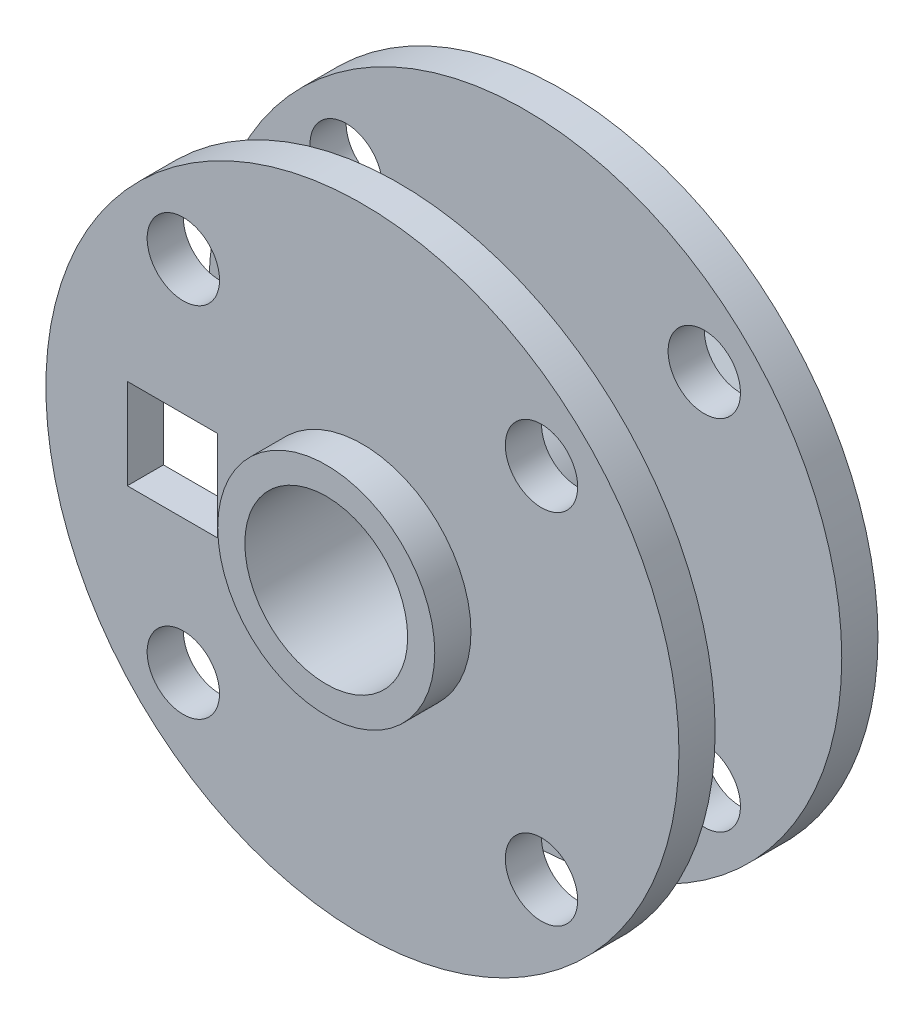
from build123d import *

# Parameters (mm, degrees)
SKETCH_1_R          = 17.5
EXTRUDE_1_DEPTH     = 2
SKETCH_2_R          = 7
EXTRUDE_2_DEPTH     = 7
SKETCH_3_R          = 17.5
EXTRUDE_3_DEPTH     = 2
SKETCH_4_W          = 5
SKETCH_4_H          = 5
CUT_EXTRUDE_1_DEPTH = 18
SKETCH_5_R          = 4.5
CUT_EXTRUDE_2_DEPTH = 18
SKETCH_6_R          = 6
SKETCH_6_R_2        = 4.5
EXTRUDE_4_DEPTH     = 2
SKETCH_7_R          = 2
CUT_EXTRUDE_3_DEPTH = 20
EXTRUDE_START       = 2
SKETCH_8_R          = 6
SKETCH_8_R_2        = 4.5
EXTRUDE_5_DEPTH     = 2
EXTRUDE_START_2     = 3
SKETCH_10_R         = 4.5
EXTRUDE_6_DEPTH     = 3


with BuildPart() as part:
    # 草图1 → 凸台-拉伸1 (new body)
    with BuildSketch(Plane.XY):
        Circle(SKETCH_1_R)
    extrude(amount=EXTRUDE_1_DEPTH)

    # 草图2 → 凸台-拉伸2 (add)
    with BuildSketch(Plane.XY.offset(2)):
        Circle(SKETCH_2_R)
    extrude(amount=EXTRUDE_2_DEPTH)

    # 草图3 → 凸台-拉伸3 (add)
    with BuildSketch(Plane.XY.offset(9)):
        Circle(SKETCH_3_R)
    extrude(amount=EXTRUDE_3_DEPTH)

    # 草图4 → 切除-拉伸1 (cut)
    with BuildSketch(Plane.XY.offset(11)):
        with Locations((-10.5, 0)):
            Rectangle(SKETCH_4_W, SKETCH_4_H)
    extrude(amount=-CUT_EXTRUDE_1_DEPTH, mode=Mode.SUBTRACT)

    # 草图5 → 切除-拉伸2 (cut)
    with BuildSketch(Plane(origin=(0, 0, 0), x_dir=(-1, 0, 0), z_dir=(0, 0, -1))):
        Circle(SKETCH_5_R)
    extrude(amount=-CUT_EXTRUDE_2_DEPTH, mode=Mode.SUBTRACT)

    # 草图6 → 凸台-拉伸4 (add)
    with BuildSketch(Plane.XY.offset(11)):
        Circle(SKETCH_6_R)
        with Locations(Location((0, 0, 0), (0, 0, 180))):
            Circle(SKETCH_6_R_2, mode=Mode.SUBTRACT)
    extrude(amount=EXTRUDE_4_DEPTH)

    # 草图7 → 切除-拉伸3 (cut)
    with BuildSketch(Plane.XY.offset(11)):
        with Locations((-9.899494937, 9.899494937)):
            Circle(SKETCH_7_R)
        with Locations((9.899494937, 9.899494937)):
            Circle(SKETCH_7_R)
        with Locations((9.899494937, -9.899494937)):
            Circle(SKETCH_7_R)
        with Locations((-9.899494937, -9.899494937)):
            Circle(SKETCH_7_R)
    extrude(amount=-CUT_EXTRUDE_3_DEPTH, mode=Mode.SUBTRACT)

    # 草图8 → 凸台-拉伸5 (add)
    with BuildSketch(Plane(origin=(0, 0, 0), x_dir=(-1, 0, 0), z_dir=(0, 0, -1)).offset(EXTRUDE_START)):
        with Locations(Location((0, 0, 0), (0, 0, 180))):
            Circle(SKETCH_8_R)
        Circle(SKETCH_8_R_2, mode=Mode.SUBTRACT)
    extrude(amount=-EXTRUDE_5_DEPTH)

    # 草图10 → 凸台-拉伸6 (add)
    with BuildSketch(Plane(origin=(0, 0, -2), x_dir=(-1, 0, 0), z_dir=(0, 0, -1)).offset(EXTRUDE_START_2)):
        Polygon((0, 8.082903769), (-7, 4.041451884), (-7, -4.041451884), (0, -8.082903769), (7, -4.041451884), (7, 4.041451884), align=None)
        Circle(SKETCH_10_R, mode=Mode.SUBTRACT)
    extrude(amount=-EXTRUDE_6_DEPTH)


solid = part.part
